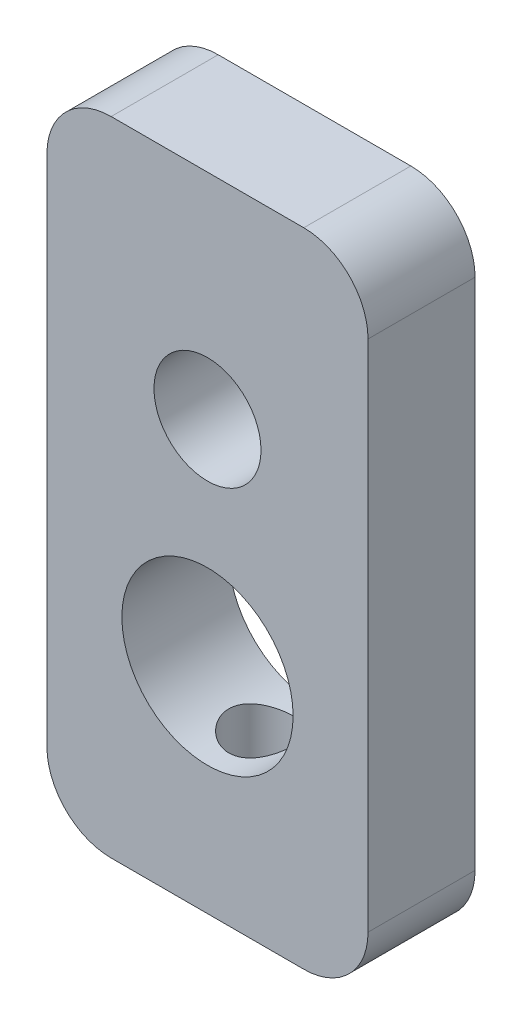
from build123d import *

# Parameters (mm, degrees)
SKETCH1_W           = 15
SKETCH1_H           = 30
SKETCH1_R           = 4
BOSS_EXTRUDE1_DEPTH = 5
SKETCH3_R           = 1.5
CUT_EXTRUDE1_DEPTH  = 30
SKETCH2_R           = 2.5
CUT_EXTRUDE2_DEPTH  = 10
FILLET1_R           = 3


with BuildPart() as part:
    # Sketch1 → Boss-Extrude1 (new body)
    with BuildSketch(Plane.XY):
        with Locations((0, 5)):
            Rectangle(SKETCH1_W, SKETCH1_H)
        Circle(SKETCH1_R, mode=Mode.SUBTRACT)
    extrude(amount=BOSS_EXTRUDE1_DEPTH)

    # Sketch3 → Cut-Extrude1 (cut)
    with BuildSketch(Plane(origin=(0, 0, 0), x_dir=(0, 0, -1), z_dir=(0, 1, 0))):
        with Locations(Location((-2.5, 0, 0), (0, 0, 180))):
            Circle(SKETCH3_R)
    extrude(amount=-CUT_EXTRUDE1_DEPTH, mode=Mode.SUBTRACT)

    # Sketch2 → Cut-Extrude2 (cut)
    with BuildSketch(Plane(origin=(0, -24.379216841, 5), x_dir=(1, 0, 0), z_dir=(0, 0, -1))):
        with Locations((0, -34.379216841)):
            Circle(SKETCH2_R)
    extrude(amount=CUT_EXTRUDE2_DEPTH, mode=Mode.SUBTRACT)

    # Fillet1
    fillet1_edges = [part.edges().sort_by_distance(p)[0] for p in [
        (-7.5, 20, 2.5),
        (7.5, 20, 2.5),
        (7.5, -10, 2.5),
        (-7.5, -10, 2.5),
    ]]
    fillet(fillet1_edges, radius=FILLET1_R)


solid = part.part
